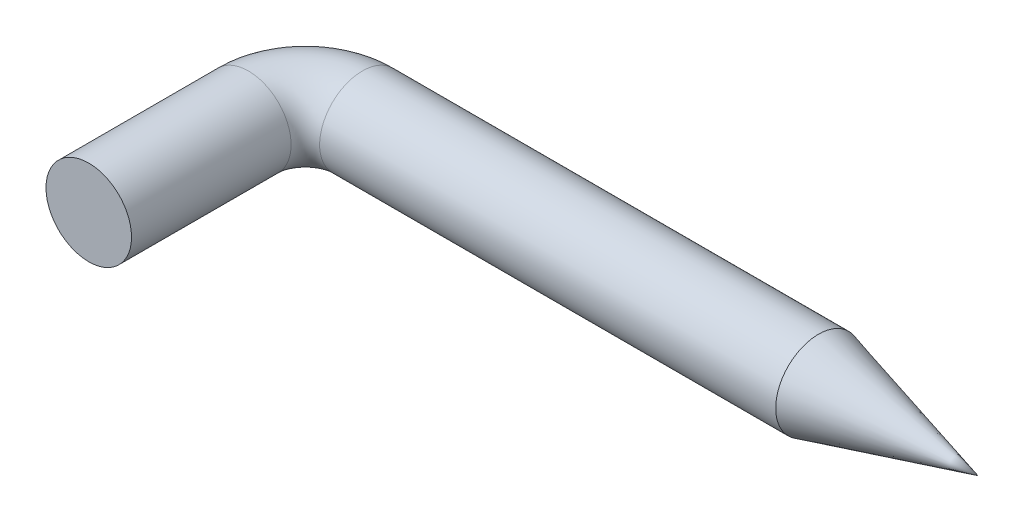
from build123d import *

# Parameters (mm, degrees)
ESQUISSE1_R = 7.5


with BuildPart() as part:
    # Balayage1: sweep along a path in Esquisse3
    with BuildLine(Plane(origin=(0, 0, 0), x_dir=(1, 0, 0), z_dir=(0, 1, 0))) as balayage1_path:
        Line((0, 0), (0, 28))
        ThreePointArc((0, 28), (2.928932188, 35.071067812), (10, 38))
        Line((10, 38), (90, 38))
    # Esquisse1 → Balayage1 (sweep)
    with BuildSketch(Plane.XY):
        Circle(ESQUISSE1_R)
    sweep(path=balayage1_path.line)

    # Boss.-Extru.2 cone 1 section (through the dimple's axis) → Boss.-Extru.2 (revolve)
    with BuildSketch(Plane(origin=(90, 0, -38), x_dir=(0, 0, 1), z_dir=(0, 1, 0))):
        Polygon((0, 0), (7.5, 0), (0, 27.990381057), align=None)
    revolve(axis=Axis((90, 0, -38), (1, 0, 0)))


solid = part.part
